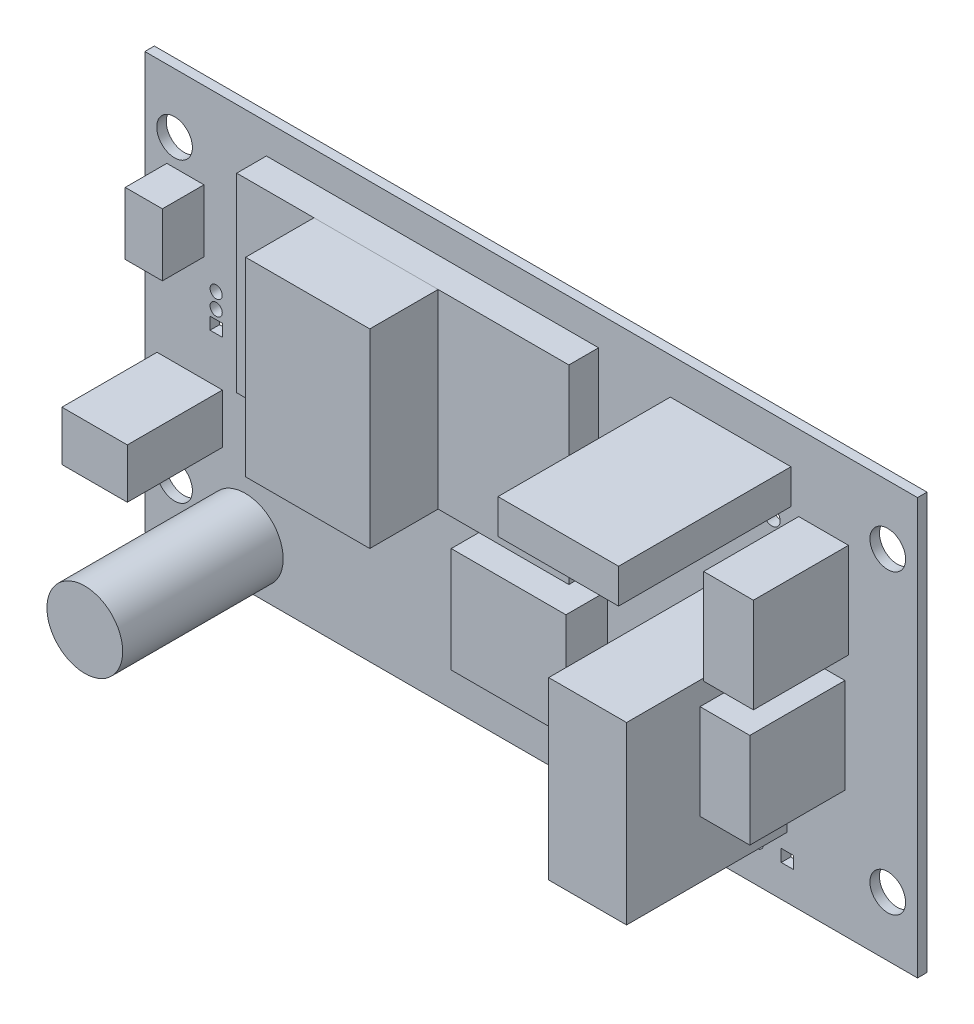
from build123d import *

# Parameters (mm, degrees)
MODEL_W               = 130
MODEL_H               = 70
MODEL_R               = 3
MODEL_R_2             = 3.375
MODEL_R_3             = 1.025
MODEL_R_4             = 0.95
MODEL_R_5             = 1.4
MODEL_R_6             = 1.25
MODEL_R_7             = 1.35
MODEL_R_8             = 0.7
MODEL_W_2             = 6.75
MODEL_H_2             = 6.75
MODEL_W_3             = 2.05
MODEL_H_3             = 2.05
MODEL_W_4             = 1.9
MODEL_H_4             = 1.9
MODEL_W_5             = 2.8
MODEL_H_5             = 2.8
MODEL_W_6             = 2.5
MODEL_H_6             = 2.5
MODEL_W_7             = 2.7
MODEL_H_7             = 2.7
MODEL_W_8             = 1.4
MODEL_H_8             = 1.4
BOSS_EXTRUDE1_DEPTH   = 1.6
SKETCH4_W             = 8.378
SKETCH4_H             = 15.985
BOSS_EXTRUDE2_DEPTH   = 16
BOSS_EXTRUDE2_2_DEPTH = 16
SKETCH5_R             = 6.375
BOSS_EXTRUDE3_DEPTH   = 27
SKETCH5_W             = 13.1
SKETCH5_H             = 29.5
BOSS_EXTRUDE3_2_DEPTH = 27
SKETCH6_W             = 19.3
SKETCH6_H             = 17.7
BOSS_EXTRUDE4_DEPTH   = 7
SKETCH7_W             = 20.295
SKETCH7_H             = 5.81
BOSS_EXTRUDE5_DEPTH   = 29
SKETCH9_W             = 6.25
SKETCH9_H             = 10.5
BOSS_EXTRUDE7_DEPTH   = 7
SKETCH11_W            = 11
SKETCH11_H            = 8.36
BOSS_EXTRUDE8_DEPTH   = 16
SKETCH12_W            = 55.89
SKETCH12_H            = 32
BOSS_EXTRUDE9_DEPTH   = 5
SKETCH8_W             = 20.89
SKETCH8_H             = 32
BOSS_EXTRUDE6_DEPTH   = 11.5


with BuildPart() as part:
    # Model → Boss-Extrude1 (new body)
    with BuildSketch(Plane.XY):
        with Locations((65, 35)):
            Rectangle(MODEL_W, MODEL_H)
        with Locations((5, 60)):
            Circle(MODEL_R, mode=Mode.SUBTRACT)
        with Locations((125, 60)):
            Circle(MODEL_R, mode=Mode.SUBTRACT)
        with Locations((125, 10)):
            Circle(MODEL_R, mode=Mode.SUBTRACT)
        with Locations((5, 10)):
            Circle(MODEL_R, mode=Mode.SUBTRACT)
        with Locations((113.6, 25.6)):
            Circle(MODEL_R_2, mode=Mode.SUBTRACT)
        with Locations((114.2, 45.6)):
            Circle(MODEL_R_2, mode=Mode.SUBTRACT)
        with Locations((87.92, 6.4)):
            Circle(MODEL_R_3, mode=Mode.SUBTRACT)
        with Locations((103.02, 6.4)):
            Circle(MODEL_R_3, mode=Mode.SUBTRACT)
        with Locations((97.95, 22.22)):
            Circle(MODEL_R_4, mode=Mode.SUBTRACT)
        with Locations((97.95, 17.22)):
            Circle(MODEL_R_4, mode=Mode.SUBTRACT)
        with Locations((97.95, 12.22)):
            Circle(MODEL_R_4, mode=Mode.SUBTRACT)
        with Locations((105.45, 12.22)):
            Circle(MODEL_R_4, mode=Mode.SUBTRACT)
        with Locations((105.45, 17.22)):
            Circle(MODEL_R_4, mode=Mode.SUBTRACT)
        with Locations((105.45, 22.22)):
            Circle(MODEL_R_4, mode=Mode.SUBTRACT)
        with Locations((105.45, 37.22)):
            Circle(MODEL_R_4, mode=Mode.SUBTRACT)
        with Locations((105.5, 55.02)):
            Circle(MODEL_R_5, mode=Mode.SUBTRACT)
        with Locations((6.8, 21.04)):
            Circle(MODEL_R_6, mode=Mode.SUBTRACT)
        with Locations((98.561, 60.8)):
            Circle(MODEL_R_7, mode=Mode.SUBTRACT)
        with Locations((104.022, 60.8)):
            Circle(MODEL_R_7, mode=Mode.SUBTRACT)
        with Locations((6.3, 50.3)):
            Circle(MODEL_R_8, mode=Mode.SUBTRACT)
        with Locations((6.3, 52.8)):
            Circle(MODEL_R_8, mode=Mode.SUBTRACT)
        with Locations((21.73, 60.43)):
            Circle(MODEL_R_3, mode=Mode.SUBTRACT)
        with Locations((21.73, 57.89)):
            Circle(MODEL_R_3, mode=Mode.SUBTRACT)
        with Locations((21.73, 55.35)):
            Circle(MODEL_R_3, mode=Mode.SUBTRACT)
        with Locations((21.73, 52.81)):
            Circle(MODEL_R_3, mode=Mode.SUBTRACT)
        with Locations((21.73, 50.27)):
            Circle(MODEL_R_3, mode=Mode.SUBTRACT)
        with Locations((21.73, 47.73)):
            Circle(MODEL_R_3, mode=Mode.SUBTRACT)
        with Locations((21.73, 45.19)):
            Circle(MODEL_R_3, mode=Mode.SUBTRACT)
        with Locations((21.73, 42.65)):
            Circle(MODEL_R_3, mode=Mode.SUBTRACT)
        with Locations((21.73, 40.11)):
            Circle(MODEL_R_3, mode=Mode.SUBTRACT)
        with Locations((21.73, 37.57)):
            Circle(MODEL_R_3, mode=Mode.SUBTRACT)
        with Locations((21.73, 35.03)):
            Circle(MODEL_R_3, mode=Mode.SUBTRACT)
        with Locations((75.07, 37.57)):
            Circle(MODEL_R_3, mode=Mode.SUBTRACT)
        with Locations((75.07, 40.11)):
            Circle(MODEL_R_3, mode=Mode.SUBTRACT)
        with Locations((75.07, 42.65)):
            Circle(MODEL_R_3, mode=Mode.SUBTRACT)
        with Locations((75.07, 45.19)):
            Circle(MODEL_R_3, mode=Mode.SUBTRACT)
        with Locations((75.07, 52.81)):
            Circle(MODEL_R_3, mode=Mode.SUBTRACT)
        with Locations((75.07, 55.35)):
            Circle(MODEL_R_3, mode=Mode.SUBTRACT)
        with Locations((75.07, 57.89)):
            Circle(MODEL_R_3, mode=Mode.SUBTRACT)
        with Locations((75.07, 60.43)):
            Circle(MODEL_R_3, mode=Mode.SUBTRACT)
        with Locations((12, 38.44)):
            Circle(MODEL_R_3, mode=Mode.SUBTRACT)
        with Locations((12, 40.98)):
            Circle(MODEL_R_3, mode=Mode.SUBTRACT)
        with Locations((113.6, 32.9)):
            Rectangle(MODEL_W_2, MODEL_H_2, mode=Mode.SUBTRACT)
        with Locations((114.2, 52.9)):
            Rectangle(MODEL_W_2, MODEL_H_2, mode=Mode.SUBTRACT)
        with Locations((93, 6.4)):
            Rectangle(MODEL_W_3, MODEL_H_3, mode=Mode.SUBTRACT)
        with Locations((108.1, 6.4)):
            Rectangle(MODEL_W_3, MODEL_H_3, mode=Mode.SUBTRACT)
        with Locations((97.95, 37.22)):
            Rectangle(MODEL_W_4, MODEL_H_4, mode=Mode.SUBTRACT)
        with Locations((105.5, 44.1)):
            Rectangle(MODEL_W_5, MODEL_H_5, mode=Mode.SUBTRACT)
        with Locations((6.8, 25)):
            Rectangle(MODEL_W_6, MODEL_H_6, mode=Mode.SUBTRACT)
        with Locations((93.1, 60.8)):
            Rectangle(MODEL_W_7, MODEL_H_7, mode=Mode.SUBTRACT)
        with Locations((6.3, 47.8)):
            Rectangle(MODEL_W_8, MODEL_H_8, mode=Mode.SUBTRACT)
        with Locations((21.73, 62.97)):
            Rectangle(MODEL_W_3, MODEL_H_3, mode=Mode.SUBTRACT)
        with Locations((12, 35.9)):
            Rectangle(MODEL_W_3, MODEL_H_3, mode=Mode.SUBTRACT)
    extrude(amount=BOSS_EXTRUDE1_DEPTH)


with BuildPart() as body_2:
    # Sketch4 → Boss-Extrude2 (new body)
    with BuildSketch(Plane.XY.offset(1.6)):
        with Locations((113.6, 29.25)):
            Rectangle(SKETCH4_W, SKETCH4_H)
    extrude(amount=BOSS_EXTRUDE2_DEPTH)


with BuildPart() as body_3:
    # Sketch4 → Boss-Extrude2 2 (new body)
    with BuildSketch(Plane.XY.offset(1.6)):
        with Locations((114.2, 49.25)):
            Rectangle(SKETCH4_W, SKETCH4_H)
    extrude(amount=BOSS_EXTRUDE2_2_DEPTH)


with BuildPart() as body_4:
    # Sketch5 → Boss-Extrude3 (new body)
    with BuildSketch(Plane.XY.offset(1.6)):
        with Locations((16.9, 7.7)):
            Circle(SKETCH5_R)
    extrude(amount=BOSS_EXTRUDE3_DEPTH)


with BuildPart() as body_5:
    # Sketch5 → Boss-Extrude3 2 (new body)
    with BuildSketch(Plane.XY.offset(1.6)):
        with Locations((101.5, 25)):
            Rectangle(SKETCH5_W, SKETCH5_H)
    extrude(amount=BOSS_EXTRUDE3_2_DEPTH)


with BuildPart() as body_6:
    # Sketch6 → Boss-Extrude4 (new body)
    with BuildSketch(Plane.XY.offset(1.6)):
        with Locations((68.2, 21.5)):
            Rectangle(SKETCH6_W, SKETCH6_H)
    extrude(amount=BOSS_EXTRUDE4_DEPTH)


with BuildPart() as body_7:
    # Sketch7 → Boss-Extrude5 (new body)
    with BuildSketch(Plane.XY.offset(1.6)):
        with Locations((98.561, 60.945)):
            Rectangle(SKETCH7_W, SKETCH7_H)
    extrude(amount=BOSS_EXTRUDE5_DEPTH)


with BuildPart() as body_8:
    # Sketch9 → Boss-Extrude7 (new body)
    with BuildSketch(Plane.XY.offset(1.6)):
        with Locations((6.825, 50.3)):
            Rectangle(SKETCH9_W, SKETCH9_H)
    extrude(amount=BOSS_EXTRUDE7_DEPTH)


with BuildPart() as body_9:
    # Sketch11 → Boss-Extrude8 (new body)
    with BuildSketch(Plane.XY.offset(1.6)):
        with Locations((7.55, 23.02)):
            Rectangle(SKETCH11_W, SKETCH11_H)
    extrude(amount=BOSS_EXTRUDE8_DEPTH)


with BuildPart() as body_10:
    # Sketch12 → Boss-Extrude9 (new body)
    with BuildSketch(Plane.XY.offset(1.6)):
        with Locations((48.4, 49)):
            Rectangle(SKETCH12_W, SKETCH12_H)
    extrude(amount=BOSS_EXTRUDE9_DEPTH)


with BuildPart() as body_11:
    # Sketch8 → Boss-Extrude6 (new body)
    with BuildSketch(Plane.XY.offset(6.6)):
        with Locations((43.9, 49)):
            Rectangle(SKETCH8_W, SKETCH8_H)
    extrude(amount=BOSS_EXTRUDE6_DEPTH)


solid = Compound([part.part, body_2.part, body_3.part, body_4.part, body_5.part, body_6.part, body_7.part, body_8.part, body_9.part, body_10.part, body_11.part])
